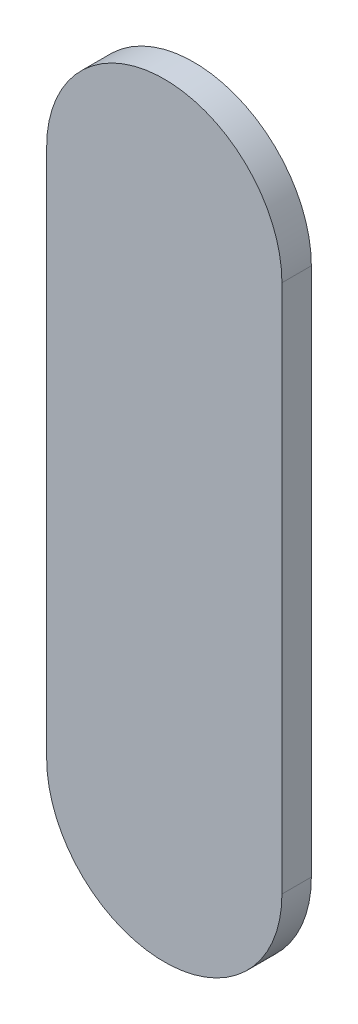
from build123d import *

# Parameters (mm, degrees)
EXTRUDE_1_DEPTH = 10


with BuildPart() as part:
    # 草图1 → 凸台-拉伸1 (new body)
    with BuildSketch(Plane.XY):
        with BuildLine():
            Line((-40, 0), (-40, -180))
            ThreePointArc((-40, -180), (0, -220), (40, -180))
            Line((40, -180), (40, 0))
            ThreePointArc((40, 0), (0, 40), (-40, 0))
        make_face()
    extrude(amount=EXTRUDE_1_DEPTH)


solid = part.part
